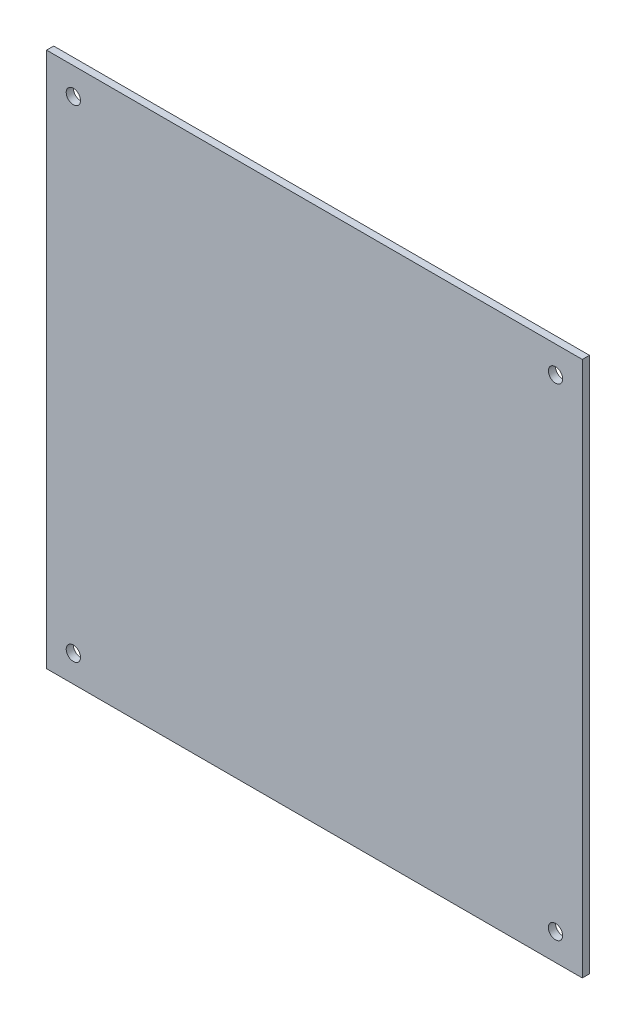
from build123d import *

# Parameters (mm, degrees)
CROQUIS1_W              = 150
CROQUIS1_H              = 150
SALIENTE_EXTRUIR1_DEPTH = 2
CROQUIS3_R              = 2
CORTAR_EXTRUIR2_DEPTH   = 2


with BuildPart() as part:
    # Croquis1 → Saliente-Extruir1 (new body)
    with BuildSketch(Plane.XY):
        Rectangle(CROQUIS1_W, CROQUIS1_H)
    extrude(amount=SALIENTE_EXTRUIR1_DEPTH)

    # Croquis3 → Cortar-Extruir2 (cut)
    with BuildSketch(Plane.XY.offset(2)):
        with Locations((-67.5, -67.5)):
            Circle(CROQUIS3_R)
        with Locations((67.5, -67.5)):
            Circle(CROQUIS3_R)
        with Locations((67.5, 67.5)):
            Circle(CROQUIS3_R)
        with Locations((-67.5, 67.5)):
            Circle(CROQUIS3_R)
    extrude(amount=-CORTAR_EXTRUIR2_DEPTH, mode=Mode.SUBTRACT)


solid = part.part
